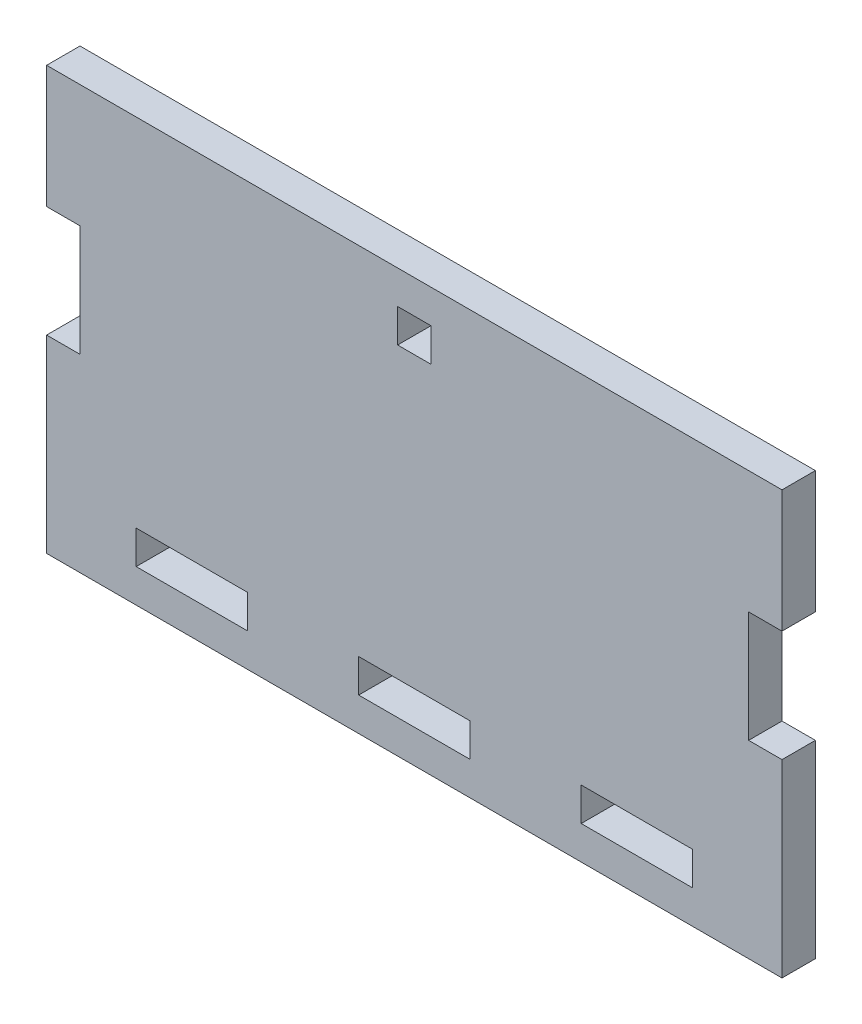
from build123d import *

# Parameters (mm, degrees)
SKETCH1_W           = 10
SKETCH1_H           = 3
SKETCH1_W_2         = 3
BOSS_EXTRUDE1_DEPTH = 3


with BuildPart() as part:
    # Sketch1 → Boss-Extrude1 (new body)
    with BuildSketch(Plane.XY):
        Polygon((4.993890114, 24.809336695), (-61.106109886, 24.809336695), (-61.106109886, 13.809336695), (-58.106109886, 13.809336695), (-58.106109886, 3.809336695), (-61.106109886, 3.809336695), (-61.106109886, -13.190663305), (4.993890114, -13.190663305), (4.993890114, 3.809336695), (1.993890114, 3.809336695), (1.993890114, 13.809336695), (4.993890114, 13.809336695), align=None)
        with Locations((-28.056109886, -8.690663305)):
            Rectangle(SKETCH1_W, SKETCH1_H, mode=Mode.SUBTRACT)
        with Locations((-28.056109886, 20.309336695)):
            Rectangle(SKETCH1_W_2, SKETCH1_H, mode=Mode.SUBTRACT)
        with Locations((-8.056109886, -8.690663305)):
            Rectangle(SKETCH1_W, SKETCH1_H, mode=Mode.SUBTRACT)
        with Locations((-48.056109886, -8.690663305)):
            Rectangle(SKETCH1_W, SKETCH1_H, mode=Mode.SUBTRACT)
    extrude(amount=BOSS_EXTRUDE1_DEPTH)


solid = part.part
